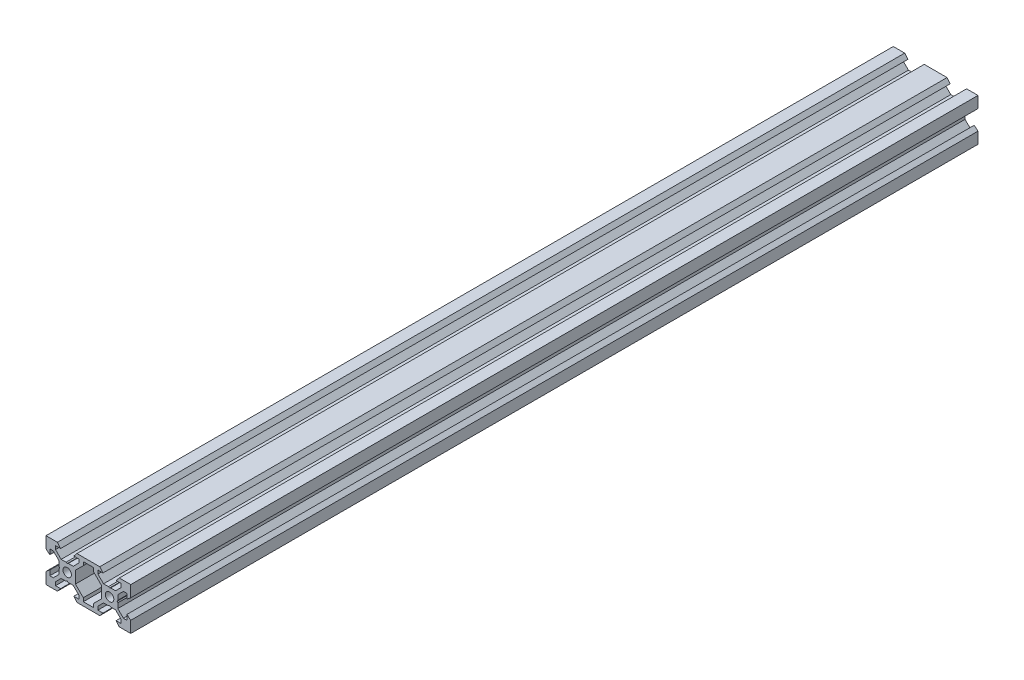
from build123d import *

# Parameters (mm, degrees)
SKETCH1_R           = 2
BOSS_EXTRUDE1_DEPTH = 400


with BuildPart() as part:
    # Sketch1 → Boss-Extrude1 (new body)
    with BuildSketch(Plane.XY):
        Polygon((-5.389620664, 10), (5.389620664, 10), (6.9, 8.2), (4.5, 8.2), (4.5, 6.556171609), (7.151917065, 3.899773171), (9.480384758, 3.899773171), (10, 3.599773171), (10.519615242, 3.899773171), (12.848082935, 3.899773171), (15.5, 6.556171609), (15.5, 8.2), (13.1, 8.2), (14.610379336, 10), (20, 10), (20, 4.610379336), (18.2, 3.1), (18.2, 5.5), (16.556171609, 5.5), (13.9, 2.839339828), (13.9, 0.519615231), (13.599999981, 0), (13.9, -0.519615231), (13.9, -2.839339828), (16.556171609, -5.5), (18.2, -5.5), (18.2, -3.1), (20, -4.610379336), (20, -10), (14.610379336, -10), (13.1, -8.2), (15.5, -8.2), (15.5, -6.556171609), (12.839339828, -3.9), (10.519222362, -3.9), (10, -3.600226829), (9.480777638, -3.9), (7.160660172, -3.9), (4.5, -6.556171609), (4.5, -8.2), (6.9, -8.2), (5.389620664, -10), (-5.389620664, -10), (-6.9, -8.2), (-4.5, -8.2), (-4.5, -6.556171609), (-7.160432959, -3.900226829), (-9.480384758, -3.900226829), (-10, -3.600226829), (-10.519615242, -3.900226829), (-12.839339828, -3.9), (-15.5, -6.556171609), (-15.5, -8.2), (-13.1, -8.2), (-14.610379336, -10), (-20, -10), (-20, -4.610379336), (-18.2, -3.1), (-18.2, -5.5), (-16.556171609, -5.5), (-13.9, -2.839339828), (-13.9, -0.519615231), (-13.599999981, 0), (-13.9, 0.519615231), (-13.9, 2.839339828), (-16.556171609, 5.5), (-18.2, 5.5), (-18.2, 3.1), (-20, 4.610379336), (-20, 10), (-14.610379336, 10), (-13.1, 8.2), (-15.5, 8.2), (-15.5, 6.556171609), (-12.839339828, 3.9), (-10.519615242, 3.899773171), (-10, 3.599773171), (-9.480384758, 3.899773171), (-7.160660172, 3.9), (-4.5, 6.556171609), (-4.5, 8.2), (-6.9, 8.2), align=None)
        with Locations((-10, 0)):
            Circle(SKETCH1_R, mode=Mode.SUBTRACT)
        with Locations((10, 0)):
            Circle(SKETCH1_R, mode=Mode.SUBTRACT)
        Polygon((-6.1, -2.839339828), (-2.376887287, -6.556171609), (-2.376887287, -8.2), (2.376887287, -8.2), (2.376887287, -6.556171609), (6.1, -2.839339828), (6.1, 2.839339828), (2.383168219, 6.556171609), (2.383168219, 8.2), (-2.383168219, 8.2), (-2.383168219, 6.556171609), (-6.1, 2.839339828), align=None, mode=Mode.SUBTRACT)
    extrude(amount=BOSS_EXTRUDE1_DEPTH)


solid = part.part
